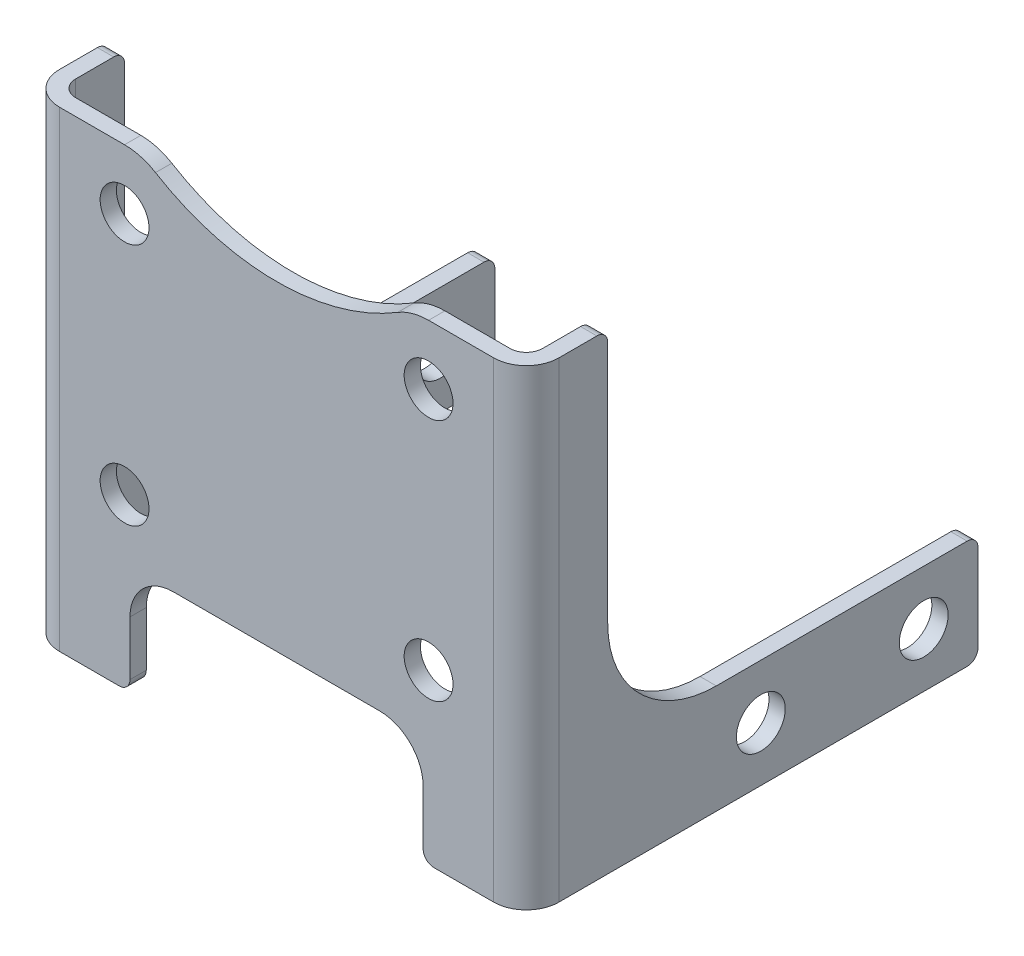
from build123d import *

# Parameters (mm, degrees)
SKETCH_1_W                  = 46
SKETCH_1_H                  = 43.413207239
EXTRUDE_1_DEPTH             = 41.6
SKETCH_2_W                  = 43
SKETCH_2_H                  = 40.1
CUT_EXTRUDE_1_DEPTH         = 64.417005312
SKETCH_3_W                  = 27
SKETCH_3_H                  = 10
CUT_EXTRUDE_2_DEPTH         = 78.334080456
SKETCH_4_W                  = 34.1
SKETCH_4_H                  = 33.413207239
CUT_EXTRUDE_3_DEPTH         = 86.49421033
SKETCH_5_W                  = 34.1
SKETCH_5_H                  = 33.413207239
CUT_EXTRUDE_4_DEPTH         = 87.284471372
CUT_EXTRUDE_5_DEPTH         = 78.334080456
HOLE_WIZARD_4_5_4_5_1_D     = 4.5
HOLE_WIZARD_4_5_4_5_1_DEPTH = 1.5
HOLE_WIZARD_4_5_4_5_2_D     = 4.5
HOLE_WIZARD_4_5_4_5_3_D     = 4.5
HOLE_WIZARD_4_5_4_5_3_DEPTH = 41.6
FILLET_1_R                  = 1
FILLET_2_R                  = 1.5
FILLET_3_R                  = 3
FILLET_4_R                  = 4
FILLET_5_R                  = 5.5
FILLET_6_R                  = 10


with BuildPart() as part:
    # 草图1 → 凸台-拉伸1 (new body)
    with BuildSketch(Plane(origin=(0, 0, -40.1), x_dir=(-1, 0, 0), z_dir=(0, 0, -1))):
        with Locations((0, -39.293396381)):
            Rectangle(SKETCH_1_W, SKETCH_1_H)
    extrude(amount=-EXTRUDE_1_DEPTH)

    # 草图2 → 切除-拉伸1 (cut, through all)
    with BuildSketch(Plane.XZ.offset(61)):
        with Locations((0, -20.05)):
            Rectangle(SKETCH_2_W, SKETCH_2_H)
    extrude(amount=-CUT_EXTRUDE_1_DEPTH, mode=Mode.SUBTRACT)

    # 草图3 → 切除-拉伸2 (cut, through all)
    with BuildSketch(Plane.XY.offset(1.5)):
        with Locations((0, -56)):
            Rectangle(SKETCH_3_W, SKETCH_3_H)
    extrude(amount=-CUT_EXTRUDE_2_DEPTH, mode=Mode.SUBTRACT)

    # 草图4 → 切除-拉伸3 (cut, through all)
    with BuildSketch(Plane(origin=(-21.5, 0, 0), x_dir=(0, 0, -1), z_dir=(1, 0, 0))):
        with Locations((23.05, -34.29339638)):
            Rectangle(SKETCH_4_W, SKETCH_4_H)
    extrude(amount=-CUT_EXTRUDE_3_DEPTH, mode=Mode.SUBTRACT)

    # 草图5 → 切除-拉伸4 (cut, through all)
    with BuildSketch(Plane(origin=(23, 0, 0), x_dir=(0, 0, -1), z_dir=(1, 0, 0))):
        with Locations((23.05, -34.29339638)):
            Rectangle(SKETCH_5_W, SKETCH_5_H)
    extrude(amount=-CUT_EXTRUDE_4_DEPTH, mode=Mode.SUBTRACT)

    # 草图6 → 切除-拉伸5 (cut, through all)
    with BuildSketch(Plane.XY.offset(1.5)):
        with BuildLine():
            Line((12.367486421, -17.586792761), (-12.367486421, -17.586792761))
            ThreePointArc((-12.367486421, -17.586792761), (0, -21.5), (12.367486421, -17.586792761))
        make_face()
    extrude(amount=-CUT_EXTRUDE_5_DEPTH, mode=Mode.SUBTRACT)

    # Ø4.5 (4.5) 直径孔1
    with Locations(Plane(origin=(-21.5, 0, 0), x_dir=(0, 0, -1), z_dir=(1, 0, 0))):
        with Locations((20.1, -56), (35.1, -56)):
            Hole(HOLE_WIZARD_4_5_4_5_1_D / 2, depth=HOLE_WIZARD_4_5_4_5_1_DEPTH)

    # Ø4.5 (4.5) 直径孔2 (through all)
    with Locations(Plane.ZY.offset(-21.5)):
        with Locations((-20.1, -56), (-35.1, -56)):
            Hole(HOLE_WIZARD_4_5_4_5_2_D / 2)

    # Ø4.5 (4.5) 直径孔3
    with Locations(Plane.XY.offset(1.5)):
        with Locations((-14, -45.5), (-14, -23.086792761), (14, -23.086792761), (14, -45.5)):
            Hole(HOLE_WIZARD_4_5_4_5_3_D / 2, depth=HOLE_WIZARD_4_5_4_5_3_DEPTH)

    # 圆角1
    fillet_1_edges = [part.edges().sort_by_distance(p)[0] for p in [
        (-22.25, -61, -40.1),
        (-13.5, -61, 0.75),
        (13.5, -61, 0.75),
        (22.25, -61, -40.1),
        (-22.25, -51, -40.1),
        (-22.25, -17.586792761, -6),
        (22.25, -51, -40.1),
        (22.25, -17.586792761, -6),
    ]]
    fillet(fillet_1_edges, radius=FILLET_1_R)

    # 圆角2
    fillet_2_edges = [part.edges().sort_by_distance(p)[0] for p in [
        (-21.5, -39.293396381, 0),
        (21.5, -39.293396381, 0),
    ]]
    fillet(fillet_2_edges, radius=FILLET_2_R)

    # 圆角3
    fillet_3_edges = [part.edges().sort_by_distance(p)[0] for p in [
        (-23, -39.293396381, 1.5),
        (23, -39.293396381, 1.5),
    ]]
    fillet(fillet_3_edges, radius=FILLET_3_R)

    # 圆角4
    fillet_4_edges = [part.edges().sort_by_distance(p)[0] for p in [
        (-13.5, -51, 0.75),
        (13.5, -51, 0.75),
    ]]
    fillet(fillet_4_edges, radius=FILLET_4_R)

    # 圆角5
    fillet_5_edges = [part.edges().sort_by_distance(p)[0] for p in [
        (12.367486421, -17.586792761, 0.75),
        (-12.367486421, -17.586792761, 0.75),
    ]]
    fillet(fillet_5_edges, radius=FILLET_5_R)

    # 圆角6
    fillet_6_edges = [part.edges().sort_by_distance(p)[0] for p in [
        (-22.25, -51, -6),
        (22.25, -51, -6),
    ]]
    fillet(fillet_6_edges, radius=FILLET_6_R)


solid = part.part
